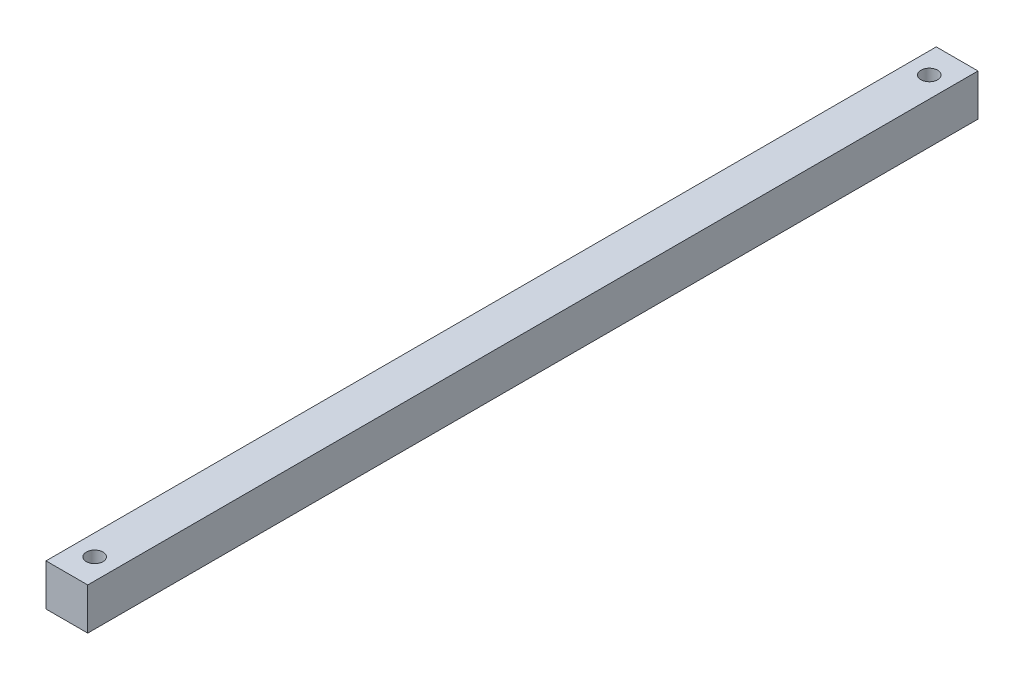
from build123d import *

# Parameters (mm, degrees)
SKETCH_1_W          = 15
SKETCH_1_H          = 15
EXTRUDE_1_DEPTH     = 320
SKETCH_2_R          = 3
CUT_EXTRUDE_1_DEPTH = 321.702354216


with BuildPart() as part:
    # 草图1 → 凸台-拉伸1 (new body)
    with BuildSketch(Plane.XY):
        with Locations((7.5, -7.5)):
            Rectangle(SKETCH_1_W, SKETCH_1_H)
    extrude(amount=EXTRUDE_1_DEPTH)

    # 草图2 → 切除-拉伸1 (cut, through all)
    with BuildSketch(Plane(origin=(0, 0, 0), x_dir=(1, 0, 0), z_dir=(0, 1, 0))):
        with Locations(Location((7.5, -310, 0), (0, 0, 270))):
            Circle(SKETCH_2_R)
        with Locations(Location((7.5, -10, 0), (0, 0, 270))):
            Circle(SKETCH_2_R)
    extrude(amount=-CUT_EXTRUDE_1_DEPTH, mode=Mode.SUBTRACT)


solid = part.part
